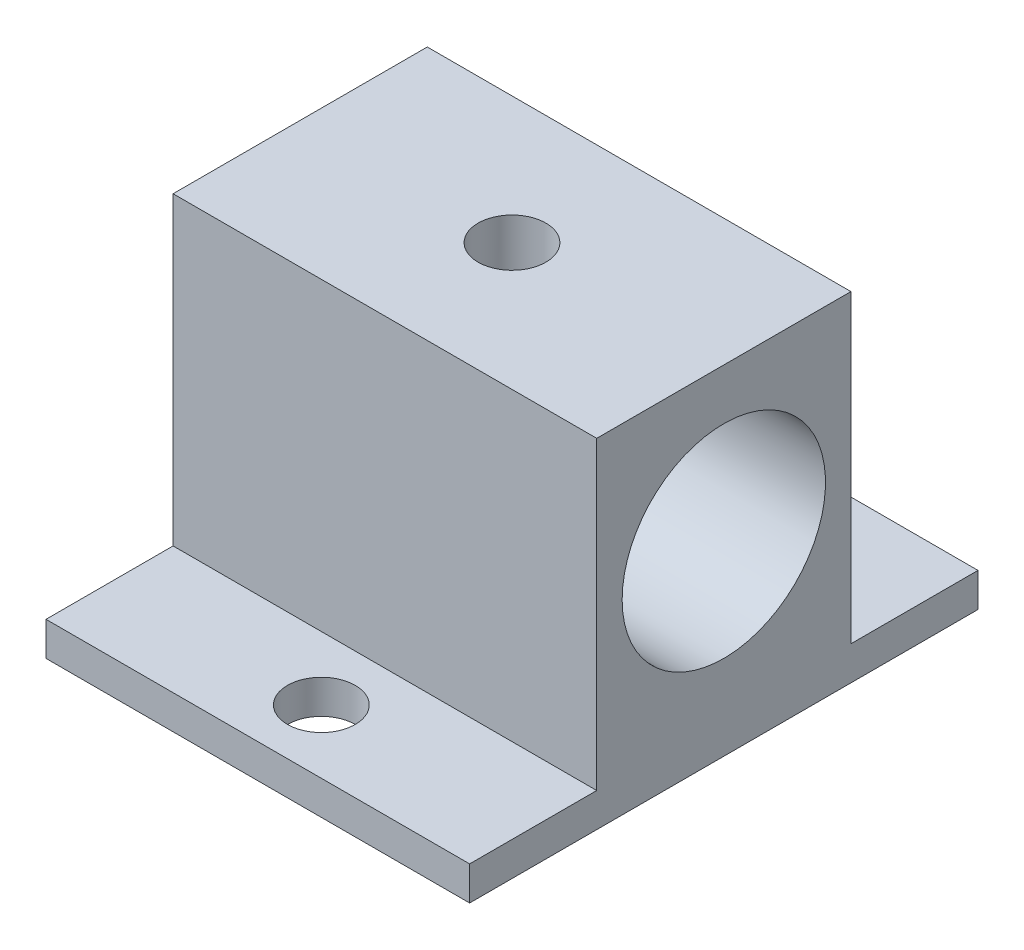
from build123d import *

# Parameters (mm, degrees)
SKETCH1_W           = 25
SKETCH1_H           = 30
BOSS_EXTRUDE1_DEPTH = 2
SKETCH2_W           = 25
SKETCH2_H           = 15
BOSS_EXTRUDE2_DEPTH = 18
SKETCH3_R           = 6
CUT_EXTRUDE1_DEPTH  = 36.355339059
SKETCH4_R           = 2
CUT_EXTRUDE2_DEPTH  = 28.950849719
SKETCH5_R           = 2
CUT_EXTRUDE3_DEPTH  = 27.556543565


with BuildPart() as part:
    # Sketch1 → Boss-Extrude1 (new body)
    with BuildSketch(Plane(origin=(0, 0, 0), x_dir=(1, 0, 0), z_dir=(0, 1, 0))):
        Rectangle(SKETCH1_W, SKETCH1_H)
    extrude(amount=BOSS_EXTRUDE1_DEPTH)

    # Sketch2 → Boss-Extrude2 (add)
    with BuildSketch(Plane(origin=(0, 2, 0), x_dir=(1, 0, 0), z_dir=(0, 1, 0))):
        Rectangle(SKETCH2_W, SKETCH2_H)
    extrude(amount=BOSS_EXTRUDE2_DEPTH)

    # Sketch3 → Cut-Extrude1 (cut, through all)
    with BuildSketch(Plane.ZY.offset(12.5)):
        with Locations((0, 11)):
            Circle(SKETCH3_R)
    extrude(amount=-CUT_EXTRUDE1_DEPTH, mode=Mode.SUBTRACT)

    # Sketch4 → Cut-Extrude2 (cut, through all)
    with BuildSketch(Plane(origin=(0, 20, 0), x_dir=(1, 0, 0), z_dir=(0, 1, 0))):
        Circle(SKETCH4_R)
    extrude(amount=-CUT_EXTRUDE2_DEPTH, mode=Mode.SUBTRACT)

    # Sketch5 → Cut-Extrude3 (cut, through all)
    with BuildSketch(Plane(origin=(0, 2, 0), x_dir=(1, 0, 0), z_dir=(0, 1, 0))):
        with Locations((0, 11.25)):
            Circle(SKETCH5_R)
        with Locations((0, -11.25)):
            Circle(SKETCH5_R)
    extrude(amount=-CUT_EXTRUDE3_DEPTH, mode=Mode.SUBTRACT)


solid = part.part
